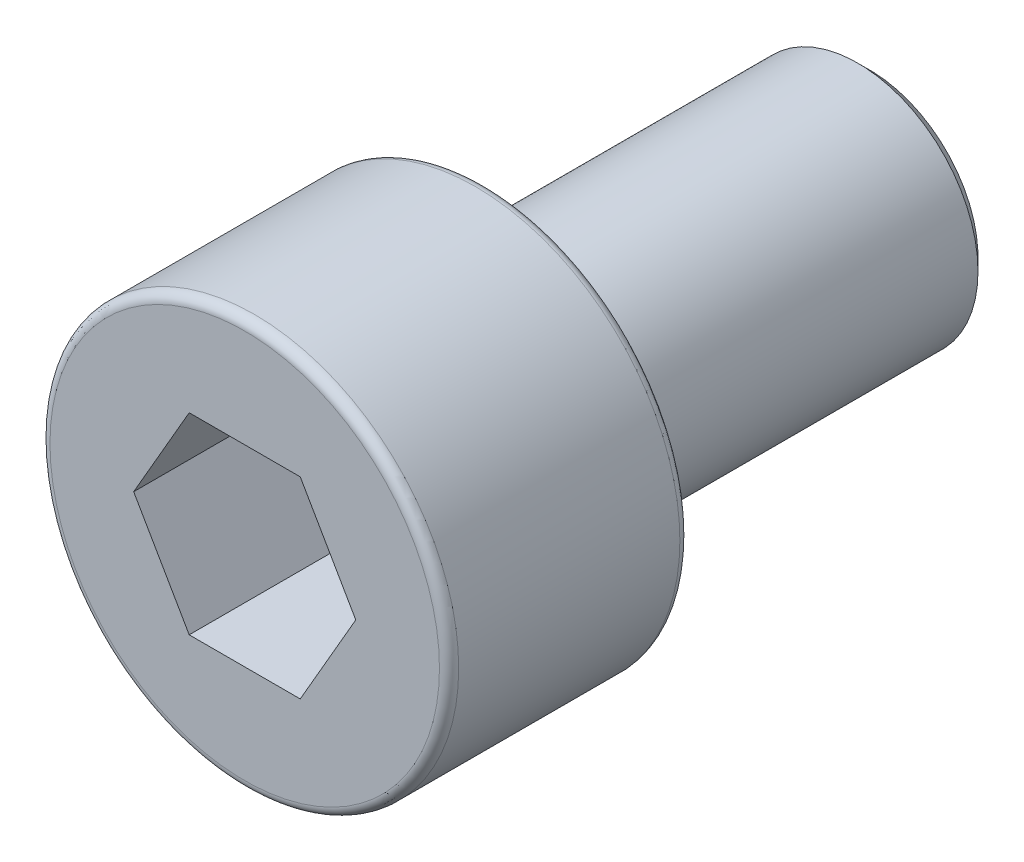
from build123d import *

# Parameters (mm, degrees)
SKETCH1_R           = 4.25
BOSS_EXTRUDE1_DEPTH = 5
SKETCH2_R           = 2.5
BOSS_EXTRUDE2_DEPTH = 8
CUT_EXTRUDE1_DEPTH  = 4
CHAMFER1_SIZE       = 0.25
FILLET1_R           = 0.2


with BuildPart() as part:
    # Sketch1 → Boss-Extrude1 (new body)
    with BuildSketch(Plane.XY.offset(13)):
        Circle(SKETCH1_R)
    extrude(amount=-BOSS_EXTRUDE1_DEPTH)

    # Sketch2 → Boss-Extrude2 (add)
    with BuildSketch(Plane(origin=(0, 0, 8), x_dir=(-1, 0, 0), z_dir=(0, 0, -1))):
        Circle(SKETCH2_R)
    extrude(amount=BOSS_EXTRUDE2_DEPTH)

    # Sketch3 → Cut-Extrude1 (cut)
    with BuildSketch(Plane.XY.offset(13)):
        Polygon((-2.309401077, 0), (-1.154700538, -2), (1.154700538, -2), (2.309401077, 0), (1.154700538, 2), (-1.154700538, 2), align=None)
    extrude(amount=-CUT_EXTRUDE1_DEPTH, mode=Mode.SUBTRACT)

    # Chamfer1
    chamfer1_edges = [part.edges().sort_by_distance(p)[0] for p in [
        (2.5, 0, 0),
    ]]
    chamfer(chamfer1_edges, length=CHAMFER1_SIZE)

    # Fillet1
    fillet1_edges = [part.edges().sort_by_distance(p)[0] for p in [
        (-4.25, 0, 8),
        (-4.25, 0, 13),
    ]]
    fillet(fillet1_edges, radius=FILLET1_R)


solid = part.part
